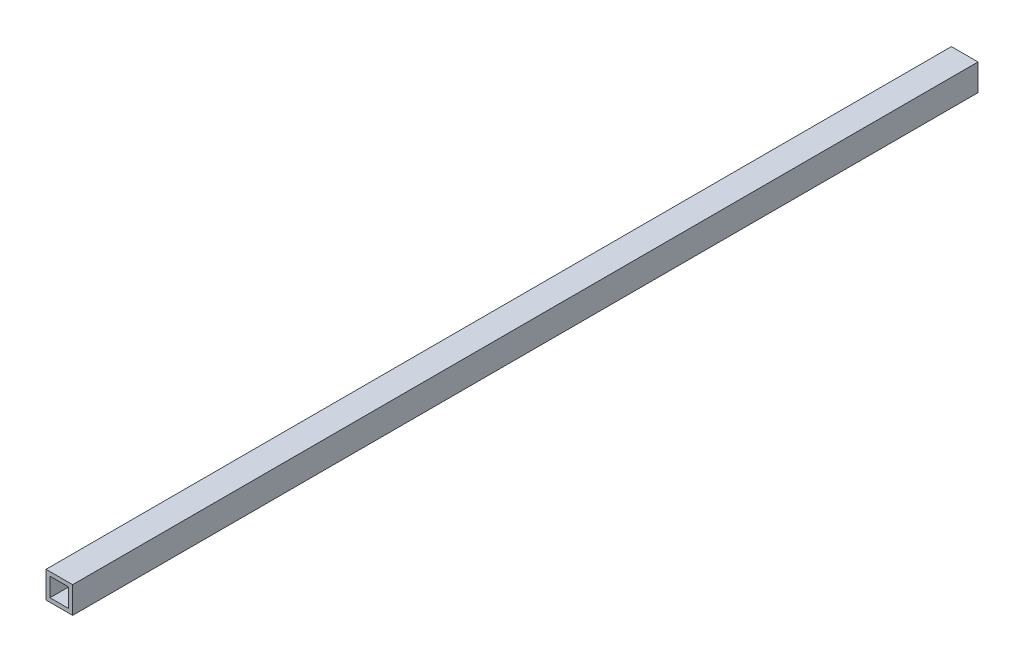
from build123d import *

# Parameters (mm, degrees)
SZKIC1_W                    = 10
SZKIC1_H                    = 10
SZKIC1_W_2                  = 7
SZKIC1_H_2                  = 7
DODANIE_WYCI_GNI_CIE1_DEPTH = 340


with BuildPart() as part:
    # Szkic1 → Dodanie-wyciągnięcie1 (new body)
    with BuildSketch(Plane.XY):
        Rectangle(SZKIC1_W, SZKIC1_H)
        Rectangle(SZKIC1_W_2, SZKIC1_H_2, mode=Mode.SUBTRACT)
    extrude(amount=DODANIE_WYCI_GNI_CIE1_DEPTH)


solid = part.part
